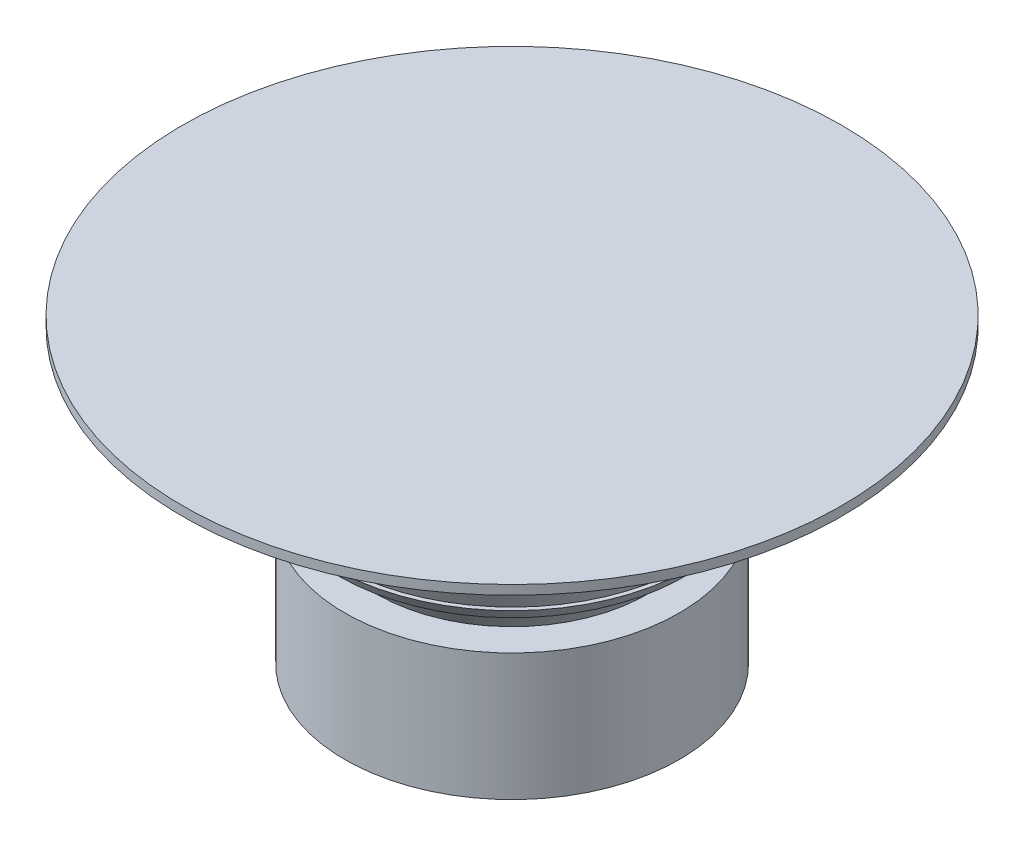
from build123d import *


with BuildPart() as part:
    # Sketch2 → Revolve1 (revolve)
    with BuildSketch(Plane.XY):
        Polygon((24.875666667, 0), (68.535, 0), (68.535, 52.035833333), (55.335666667, 52.035833333), (63.536435897, 66.2505), (0, 66.2505), (0, 0), align=None)
    revolve(axis=Axis((0, 0, 0), (0, 1, 0)))

    # Sketch3 → Revolve2 (revolve)
    with BuildSketch(Plane.XY):
        with BuildLine():
            Line((80.92907592, 94.620601836), (72.088666667, 70.8195))
            Line((72.088666667, 70.8195), (73.8655, 70.8195))
            Line((73.8655, 70.8195), (70.928285714, 66.2505))
            Line((70.928285714, 66.2505), (0, 66.2505))
            Line((0, 66.2505), (0, 109.909833333))
            Line((0, 109.909833333), (88.334, 109.909833333))
            ThreePointArc((88.334, 109.909833333), (84.396122366, 102.379234735), (80.92907592, 94.620601836))
        make_face()
    revolve(axis=Axis((0, 0, 0), (0, 1, 0)))

    # Sketch5 → Revolve3 (revolve)
    with BuildSketch(Plane.XY):
        Polygon((0, 109.909833333), (113.4635, 109.909833333), (113.4635, 119.5555), (135.039333333, 119.5555), (135.039333333, 123.363), (0, 123.363), align=None)
    revolve(axis=Axis((0, 0, 0), (0, 1, 0)))


solid = part.part
